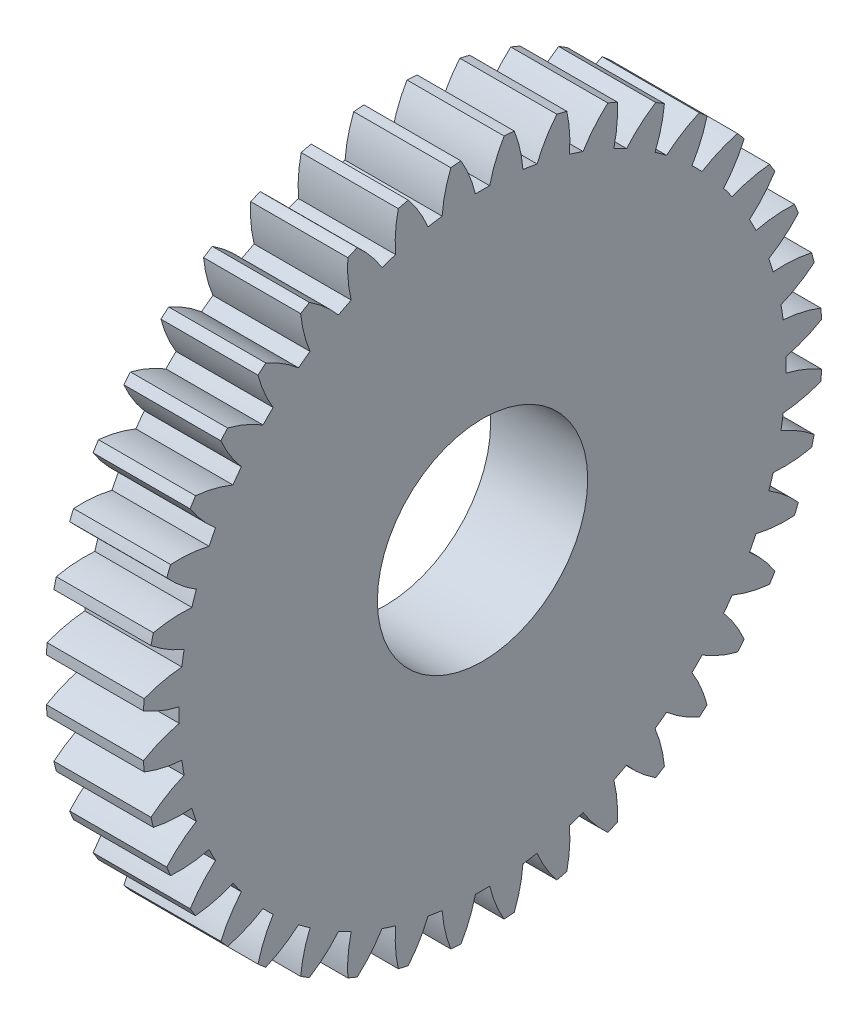
from build123d import *

# Parameters (mm, degrees)
BASPROSKE_W     = 12
BASPROSKE_H     = 42
TOOTHCUT_DEPTH  = 61.59702963
TEETHCUTS_COUNT = 40
TEETHCUTS_ANGLE = 351
BORSKE_R        = 13
BORE_DEPTH      = 50.0000508


with BuildPart() as part:
    # BasProSke → Base-Revolve (revolve)
    with BuildSketch(Plane(origin=(0, 0, 0), x_dir=(1, 0, 0), z_dir=(0, 1, 0)), mode=Mode.PRIVATE) as base_revolve_sk:
        with Locations((6, 21)):
            Rectangle(BASPROSKE_W, BASPROSKE_H)
    revolve(base_revolve_sk.sketch.rotate(Axis((-10, 0, 0), (1, 0, 0)), 180), axis=Axis((-10, 0, 0), (1, 0, 0)))

    # TooCutSke → ToothCut (cut, through all)
    with BuildSketch(Plane(origin=(0, 0, 0), x_dir=(0, 0, -1), z_dir=(1, 0, 0))):
        with BuildLine():
            ThreePointArc((0.882812088, 37.488606854), (0, 37.499), (-0.882812088, 37.488606854))
            ThreePointArc((-0.882812088, 37.488606854), (-1.612748684, 39.782000434), (-2.678427154, 41.939960338))
            ThreePointArc((-2.678427154, 41.939960338), (0, 42.0254), (2.678427154, 41.939960338))
            ThreePointArc((2.678427154, 41.939960338), (1.612748684, 39.782000434), (0.882812088, 37.488606854))
        make_face()
    toothcut = extrude(amount=TOOTHCUT_DEPTH, mode=Mode.SUBTRACT)

    # TeethCuts: ToothCut ×40 about axis
    teethcuts_axis = Axis((-10, 0, 0), (1, 0, 0))
    for i in range(1, TEETHCUTS_COUNT):
        add(toothcut.rotate(teethcuts_axis, i * TEETHCUTS_ANGLE / (TEETHCUTS_COUNT - 1)), mode=Mode.SUBTRACT)

    # BorSke → Bore (cut, symmetric)
    with BuildSketch(Plane(origin=(0, 0, 0), x_dir=(0, 0, -1), z_dir=(1, 0, 0))):
        with Locations(Location((0, 0, 0), (0, 0, 180))):
            Circle(BORSKE_R)
    extrude(amount=BORE_DEPTH, both=True, mode=Mode.SUBTRACT)


solid = part.part
